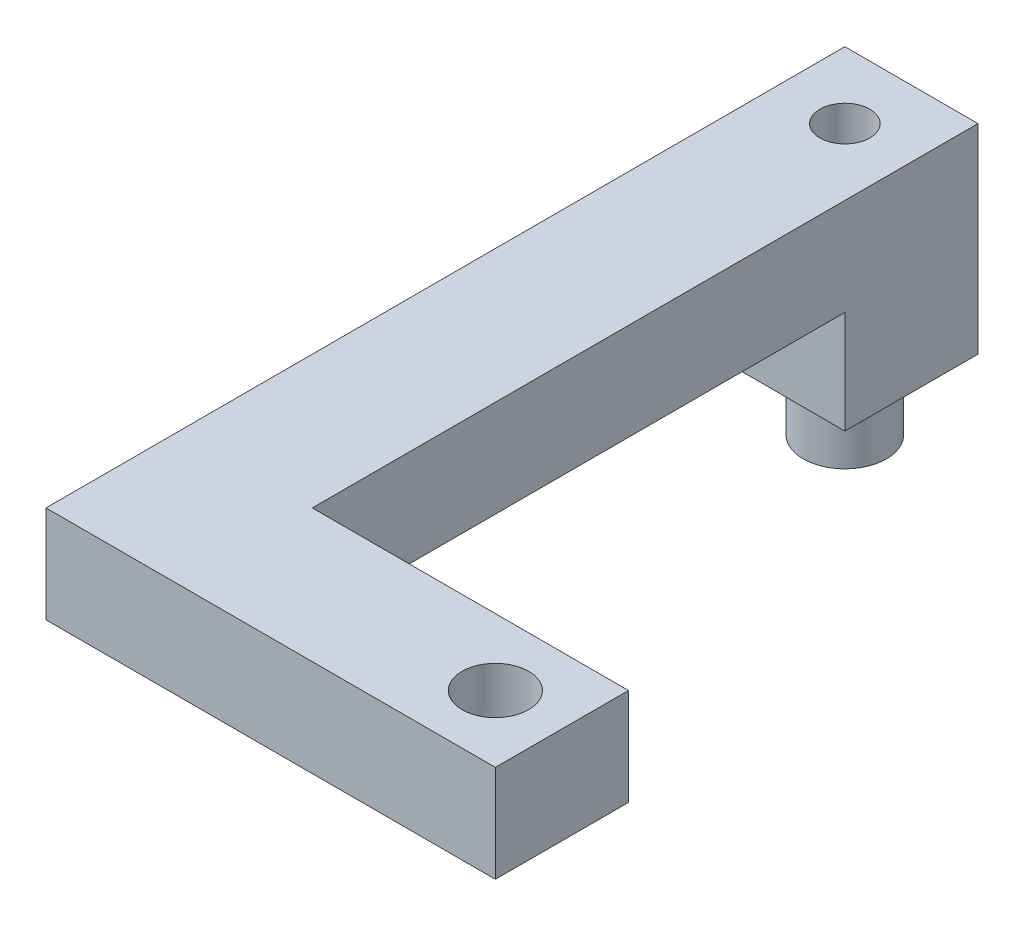
from build123d import *

# Parameters (mm, degrees)
SKETCH1_W      = 27
SKETCH1_H      = 48
EXTRUDE1_DEPTH = 12
SKETCH2_R      = 1.5
SKETCH2_R_2    = 2
SKETCH2_W      = 19
SKETCH2_H      = 40
EXTRUDE2_DEPTH = 50.510339849
SKETCH3_W      = 40
SKETCH3_H      = 6.175
EXTRUDE3_DEPTH = 53.409819068
SKETCH7_R      = 2.5
EXTRUDE7_DEPTH = 4.2


with BuildPart() as part:
    # Sketch1 → Extrude1 (new body)
    with BuildSketch(Plane(origin=(0, 0, 0), x_dir=(1, 0, 0), z_dir=(0, 1, 0))):
        with Locations((7.320293399, -19.287286064)):
            Rectangle(SKETCH1_W, SKETCH1_H)
    extrude(amount=EXTRUDE1_DEPTH)

    # Sketch2 → Extrude2 (cut, through all)
    with BuildSketch(Plane(origin=(0, 12, 0), x_dir=(1, 0, 0), z_dir=(0, 1, 0))):
        with Locations(Location((-2.179706601, 0.712713936, 0), (0, 0, 270))):
            Circle(SKETCH2_R)
        with Locations(Location((16.820293399, -39.287286064, 0), (0, 0, 270))):
            Circle(SKETCH2_R_2)
        with Locations((11.320293399, -15.287286064)):
            Rectangle(SKETCH2_W, SKETCH2_H)
    extrude(amount=-EXTRUDE2_DEPTH, mode=Mode.SUBTRACT)

    # Sketch3 → Extrude3 (cut, through all)
    with BuildSketch(Plane(origin=(20.820293399, 0, 0), x_dir=(0, 0, -1), z_dir=(1, 0, 0))):
        with Locations((-23.287286064, 3.0875)):
            Rectangle(SKETCH3_W, SKETCH3_H)
    extrude(amount=-EXTRUDE3_DEPTH, mode=Mode.SUBTRACT)

    # Sketch7 → Extrude7 (add)
    with BuildSketch(Plane.XZ):
        with Locations(Location((-2.179706601, -0.712713936, 0), (0, 0, 90))):
            Circle(SKETCH7_R)
    extrude(amount=EXTRUDE7_DEPTH)


solid = part.part
